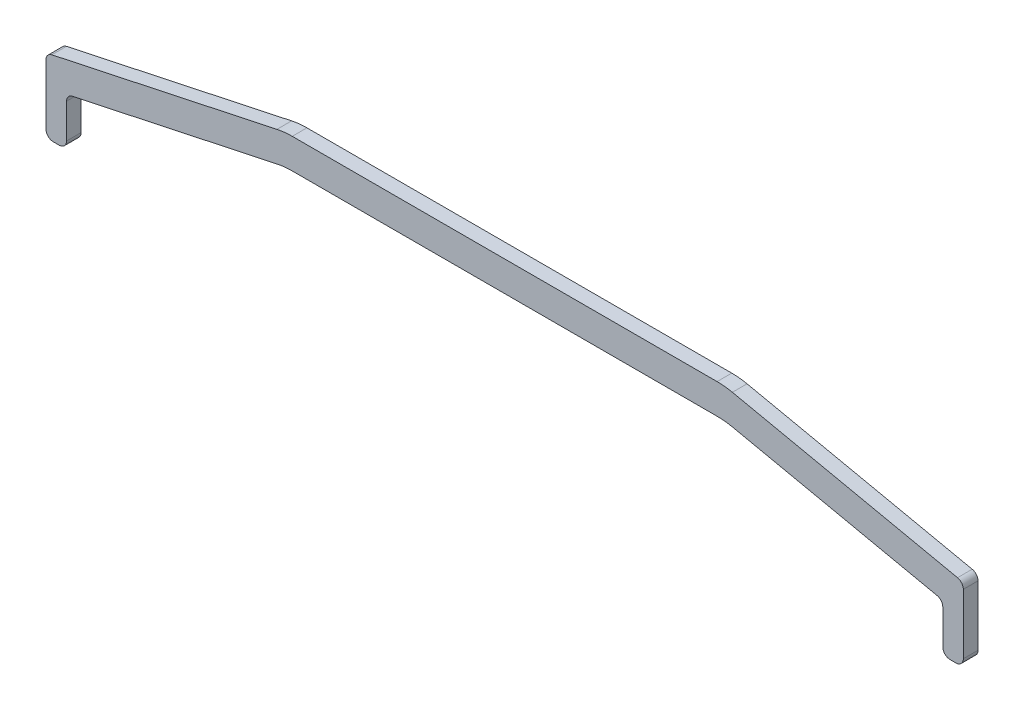
from build123d import *

# Parameters (mm, degrees)
SALIENTE_EXTRUIR1_DEPTH = 2


with BuildPart() as part:
    # Croquis1 → Saliente-Extruir1 (new body)
    with BuildSketch(Plane.XY):
        with BuildLine():
            Line((-27.468702439, 15.986263571), (30.422317404, 15.986263571))
            ThreePointArc((30.422317404, 15.986263571), (31.470993229, 15.931125511), (32.508104664, 15.766319374))
            Line((32.508104664, 15.766319374), (63.185386208, 9.223791978))
            ThreePointArc((63.185386208, 9.223791978), (63.754167993, 8.874841751), (63.976807482, 8.245786398))
            Line((63.976807482, 8.245786398), (63.976807482, 0.055005987))
            ThreePointArc((63.976807482, 0.055005987), (63.683914264, -0.652100794), (62.976807482, -0.944994013))
            Line((62.976807482, -0.944994013), (62.176807482, -0.944994013))
            ThreePointArc((62.176807482, -0.944994013), (61.469700701, -0.652100794), (61.176807482, 0.055005987))
            Line((61.176807482, 0.055005987), (61.176807482, 4.752984684))
            ThreePointArc((61.176807482, 4.752984684), (60.954167993, 5.382040037), (60.385386208, 5.730990264))
            Line((60.385386208, 5.730990264), (32.508104664, 11.67636316))
            ThreePointArc((32.508104664, 11.67636316), (31.470993229, 11.841169298), (30.422317404, 11.896307357))
            Line((30.422317404, 11.896307357), (-27.468702439, 11.896307357))
            ThreePointArc((-27.468702439, 11.896307357), (-28.517378264, 11.841169298), (-29.554489699, 11.67636316))
            Line((-29.554489699, 11.67636316), (-57.431771244, 5.730990264))
            ThreePointArc((-57.431771244, 5.730990264), (-58.000553028, 5.382040037), (-58.223192518, 4.752984684))
            Line((-58.223192518, 4.752984684), (-58.223192518, 0.055005987))
            ThreePointArc((-58.223192518, 0.055005987), (-58.516085736, -0.652100794), (-59.223192518, -0.944994013))
            Line((-59.223192518, -0.944994013), (-60.023192518, -0.944994013))
            ThreePointArc((-60.023192518, -0.944994013), (-60.730299299, -0.652100794), (-61.023192518, 0.055005987))
            Line((-61.023192518, 0.055005987), (-61.023192518, 8.245786398))
            ThreePointArc((-61.023192518, 8.245786398), (-60.800553028, 8.874841751), (-60.231771244, 9.223791978))
            Line((-60.231771244, 9.223791978), (-29.554489699, 15.766319374))
            ThreePointArc((-29.554489699, 15.766319374), (-28.517378264, 15.931125511), (-27.468702439, 15.986263571))
        make_face()
    extrude(amount=SALIENTE_EXTRUIR1_DEPTH)


solid = part.part
